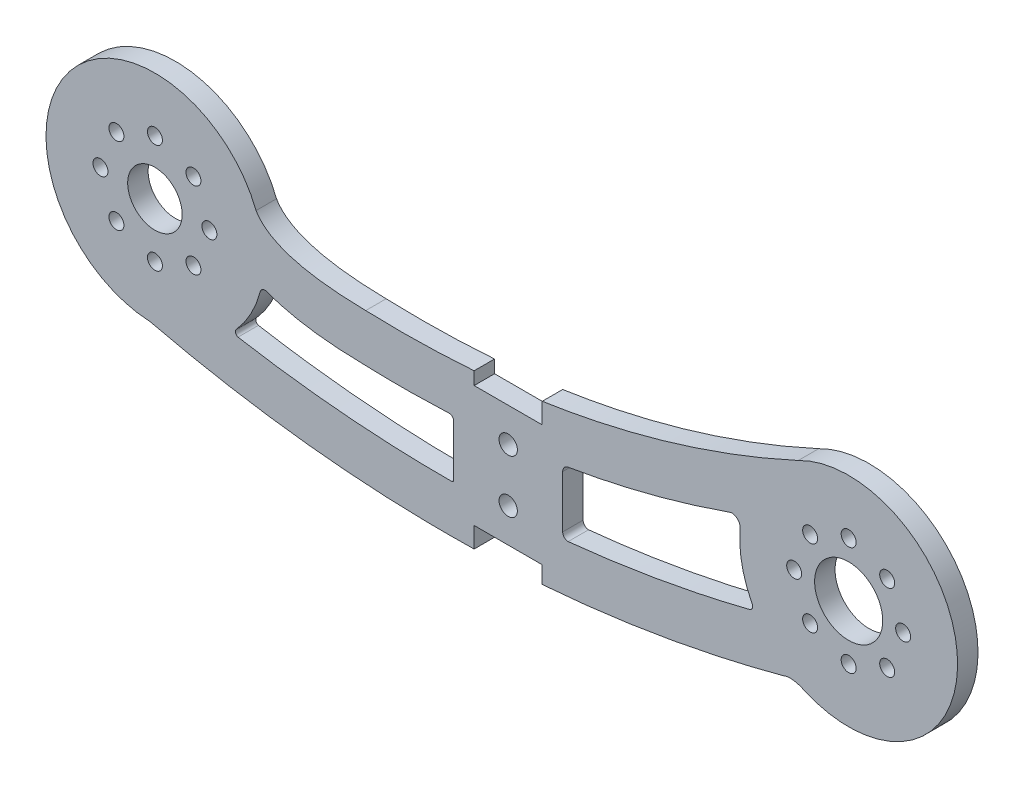
from build123d import *

# Parameters (mm, degrees)
SKETCH1_R           = 5
SKETCH1_R_2         = 1.1
SKETCH1_R_3         = 4
BOSS_EXTRUDE1_DEPTH = 3
SKETCH2_R           = 1.35
SKETCH2_W           = 10
SKETCH2_H           = 3
CUT_EXTRUDE2_DEPTH  = 5
CUT_EXTRUDE3_START  = -3
CUT_EXTRUDE3_DEPTH  = 3


with BuildPart() as part:
    # Sketch1 → Boss-Extrude1 (new body)
    with BuildSketch(Plane.XY):
        with BuildLine():
            ThreePointArc((-11.658277887, -20.5832063), (-39.551034339, -17.233624375), (-27.264419704, -42.497524754))
            add(Edge.make_bspline(
                [(-27.264419704, -42.497524754), (-25.334460253, -42.955768201), (-21.452320642, -43.816124737), (-13.705385842, -45.286858174), (-4.006421964, -46.667533574), (7.638269658, -47.586831656), (19.289241844, -47.768762722), (30.941925955, -47.212824411), (42.591601286, -45.920000504), (52.298162816, -44.228522597), (60.052175742, -42.510146288), (63.940283625, -41.52535362), (65.871739475, -41.00572578)],
                knots=[0.004189422, 0.004189422, 0.004189422, 0.004189422, 0.066427583, 0.128665745, 0.253142067, 0.377618389, 0.502094711, 0.626571033, 0.751047356, 0.875523678, 0.937761839, 1, 1, 1, 1], degree=3))
            add(Edge.make_bspline(
                [(68.935876888, -41.399946265), (67.056778784, -40.529280178), (65.871739475, -41.00572578)],
                knots=[0, 0, 0, 1, 1, 1], degree=2))
            ThreePointArc((68.935876888, -41.399946265), (91.352405248, -26.204284986), (67.957252813, -12.563327983))
            add(Edge.make_bspline(
                [(67.957252813, -12.563327983), (65.455609859, -13.713888582), (60.364787712, -15.882927404), (52.683559955, -18.641296662), (44.896066709, -20.933273776), (37.015370972, -22.752952432), (29.033864031, -24.103049266), (20.950849492, -24.983508442), (14.12359191, -25.325141054), (8.614596461, -25.364124484), (5.82883012, -25.303122311), (4.440642397, -25.254725163)],
                knots=[0.003418543, 0.003418543, 0.003418543, 0.003418543, 0.119867337, 0.236316132, 0.352764926, 0.46921372, 0.585662514, 0.702111309, 0.818560103, 0.8767845, 0.935008897, 0.935008897, 0.935008897, 0.935008897], degree=3))
            add(Edge.make_bspline(
                [(-11.658277887, -20.5832063), (-9.065688302, -25.060046308), (4.440642397, -25.254725163)],
                knots=[0, 0, 0, 1, 1, 1], degree=2))
        make_face()
        with Locations((75.361610976, -26.74696222)):
            Circle(SKETCH1_R, mode=Mode.SUBTRACT)
        with Locations((75.361610976, -18.74696222)):
            Circle(SKETCH1_R_2, mode=Mode.SUBTRACT)
        with Locations((81.018465226, -21.090107971)):
            Circle(SKETCH1_R_2, mode=Mode.SUBTRACT)
        with Locations((83.361610976, -26.74696222)):
            Circle(SKETCH1_R_2, mode=Mode.SUBTRACT)
        with Locations((-26.518107506, -26.514939916)):
            Circle(SKETCH1_R_3, mode=Mode.SUBTRACT)
        with Locations((81.018465226, -32.40381647)):
            Circle(SKETCH1_R_2, mode=Mode.SUBTRACT)
        with Locations((-26.516504294, -18.516504294)):
            Circle(SKETCH1_R_2, mode=Mode.SUBTRACT)
        with Locations((-20.859650045, -20.859650045)):
            Circle(SKETCH1_R_2, mode=Mode.SUBTRACT)
        with Locations((-18.516504294, -26.516504294)):
            Circle(SKETCH1_R_2, mode=Mode.SUBTRACT)
        with Locations((-20.859650045, -32.173358544)):
            Circle(SKETCH1_R_2, mode=Mode.SUBTRACT)
        with Locations((-26.516504294, -34.516504294)):
            Circle(SKETCH1_R_2, mode=Mode.SUBTRACT)
        with Locations((-32.173358544, -32.173358544)):
            Circle(SKETCH1_R_2, mode=Mode.SUBTRACT)
        with Locations((-34.516504294, -26.516504294)):
            Circle(SKETCH1_R_2, mode=Mode.SUBTRACT)
        with Locations((-32.173358544, -20.859650045)):
            Circle(SKETCH1_R_2, mode=Mode.SUBTRACT)
        with Locations((75.361610976, -34.74696222)):
            Circle(SKETCH1_R_2, mode=Mode.SUBTRACT)
        with Locations((69.704756727, -32.40381647)):
            Circle(SKETCH1_R_2, mode=Mode.SUBTRACT)
        with Locations((67.361610976, -26.74696222)):
            Circle(SKETCH1_R_2, mode=Mode.SUBTRACT)
        with Locations((69.704756727, -21.090107971)):
            Circle(SKETCH1_R_2, mode=Mode.SUBTRACT)
    extrude(amount=BOSS_EXTRUDE1_DEPTH)

    # Sketch2 → Cut-Extrude2 (cut)
    with BuildSketch(Plane.XY.offset(3)):
        with Locations((25.361610976, -31.831277184)):
            Circle(SKETCH2_R)
        with Locations((25.361610976, -39.625455239)):
            Circle(SKETCH2_R)
        with Locations((25.361610976, -25.331277184)):
            Rectangle(SKETCH2_W, SKETCH2_H)
        with Locations((25.361610976, -46.125455239)):
            Rectangle(SKETCH2_W, SKETCH2_H)
    extrude(amount=-CUT_EXTRUDE2_DEPTH, mode=Mode.SUBTRACT)

    # Sketch3 → Cut-Extrude3 (cut)
    with BuildSketch(Plane.XY.offset(3).offset(CUT_EXTRUDE3_START)):
        with BuildLine():
            Line((17.361610979, -32.847645213), (17.361610979, -40.364046911))
            ThreePointArc((17.361610979, -40.364046911), (17.283764857, -40.567864243), (17.089867993, -40.667891887))
            add(Edge.make_bspline(
                [(-14.312749434, -38.014569119), (-14.269650418, -38.022037001), (-14.226551001, -38.029489198), (-10.363330527, -38.696055752), (-6.541302391, -39.231722676), (3.882945868, -40.354666967), (10.485495494, -40.696055442), (17.089867993, -40.667891887)],
                knots=[0.247179417, 0.247179417, 0.247179417, 0.247179417, 0.25, 0.25, 0.5, 0.5, 0.932004212, 0.932004212, 0.932004212, 0.932004212], degree=3))
            ThreePointArc((-14.312749434, -38.014569119), (-14.669439204, -37.639304361), (-14.551126107, -37.135267416))
            ThreePointArc((-14.551126107, -37.135267416), (-12.411809014, -34.065591732), (-11.04390733, -30.583001975))
            ThreePointArc((-11.04390733, -30.583001975), (-10.714611633, -30.151374436), (-10.176280778, -30.081104386))
            add(Edge.make_bspline(
                [(4.267556159, -32.252928603), (1.852622916, -32.216188916), (-0.375859274, -32.085089658), (-3.492192372, -31.719262737), (-4.49789731, -31.56771677), (-6.440834889, -31.196104486), (-7.378139349, -30.976217552), (-8.930356181, -30.525801619), (-9.55919338, -30.317521868), (-10.176280778, -30.081104386)],
                knots=[0.002464962, 0.002464962, 0.002464962, 0.002464962, 0.25, 0.25, 0.375, 0.375, 0.5, 0.5, 0.588245737, 0.588245737, 0.588245737, 0.588245737], degree=3))
            add(Edge.make_bspline(
                [(16.700596662, -32.184353658), (15.333410228, -32.248220782), (13.962679354, -32.293390217), (11.198499486, -32.34676917), (9.803462323, -32.354507183), (7.02323328, -32.330858195), (5.642167753, -32.300269863), (4.267556159, -32.252928603)],
                knots=[0.252874617, 0.252874617, 0.252874617, 0.252874617, 0.5, 0.5, 0.75, 0.75, 0.995779377, 0.995779377, 0.995779377, 0.995779377], degree=3))
            ThreePointArc((16.700596662, -32.184353658), (17.168142051, -32.37943169), (17.361610979, -32.847645213))
        make_face()
        with BuildLine():
            Line((33.361610975, -31.278823407), (33.361610975, -38.949732453))
            ThreePointArc((33.361610975, -38.949732453), (33.595821002, -39.524545963), (34.165063011, -39.771989778))
            add(Edge.make_bspline(
                [(34.165063011, -39.771989778), (38.42004494, -39.343698243), (42.676282868, -38.762038611), (49.786416711, -37.534421652), (52.637938271, -36.973469388), (56.916570991, -36.028567717), (58.344097641, -35.696067505), (60.144263746, -35.255068175), (60.515405719, -35.16298747), (60.886425955, -35.069780201)],
                knots=[0.126769028, 0.126769028, 0.126769028, 0.126769028, 0.5, 0.5, 0.75, 0.75, 0.875, 0.875, 0.907463599, 0.907463599, 0.907463599, 0.907463599], degree=3))
            ThreePointArc((60.886425955, -35.069780201), (61.228166777, -34.682653023), (61.186664011, -34.167937798))
            ThreePointArc((61.186664011, -34.167937798), (59.68189337, -29.932312404), (59.414647943, -25.445282536))
            ThreePointArc((59.414647943, -25.445282536), (59.051007293, -24.46828568), (58.067846264, -24.121656525))
            add(Edge.make_bspline(
                [(58.067846264, -24.121656525), (55.872279142, -24.895690317), (53.666529644, -25.614427728), (45.723836534, -27.994487025), (39.921526423, -29.346512462), (34.043951004, -30.334640585)],
                knots=[0.33139413, 0.33139413, 0.33139413, 0.33139413, 0.5, 0.5, 0.934761271, 0.934761271, 0.934761271, 0.934761271], degree=3))
            ThreePointArc((34.043951004, -30.334640585), (33.550050234, -30.69635686), (33.361610975, -31.278823407))
        make_face()
    extrude(amount=CUT_EXTRUDE3_DEPTH, mode=Mode.SUBTRACT)


solid = part.part
